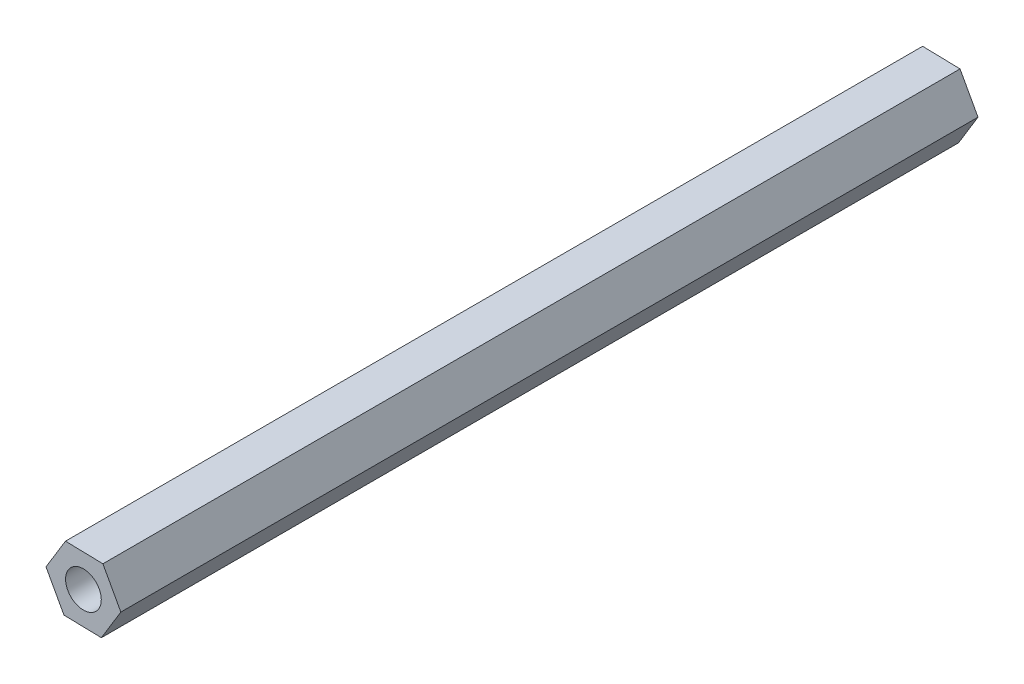
from build123d import *

# Parameters (mm, degrees)
EXTRUDE_1_DEPTH        = 60
HOLE_WIZARD_M3_1_D     = 2.5
HOLE_WIZARD_M3_1_DEPTH = 15
HOLE_WIZARD_M3_1_TIP   = 0.751075774
HOLE_WIZARD_M3_2_D     = 2.5
HOLE_WIZARD_M3_2_DEPTH = 15
HOLE_WIZARD_M3_2_TIP   = 0.751075774


with BuildPart() as part:
    # 草图1 → 凸台-拉伸1 (new body)
    with BuildSketch(Plane.XY):
        Polygon((1.363201019, 2.23742776), (-1.25606877, 2.299280593), (-2.619269789, 0.061852833), (-1.363201019, -2.23742776), (1.25606877, -2.299280593), (2.619269789, -0.061852833), align=None)
    extrude(amount=EXTRUDE_1_DEPTH)

    # M3 螺纹孔1
    with Locations(Plane.XY.offset(60)):
        with Locations((0, 0)):
            Hole(HOLE_WIZARD_M3_1_D / 2, depth=HOLE_WIZARD_M3_1_DEPTH)
            with Locations((0, 0, -(HOLE_WIZARD_M3_1_DEPTH + HOLE_WIZARD_M3_1_TIP / 2))):  # 118° drill point
                Cone(0, HOLE_WIZARD_M3_1_D / 2, HOLE_WIZARD_M3_1_TIP, mode=Mode.SUBTRACT)

    # M3 螺纹孔2
    with Locations(Plane(origin=(0, 0, 0), x_dir=(-1, 0, 0), z_dir=(0, 0, -1))):
        with Locations((0, 0)):
            Hole(HOLE_WIZARD_M3_2_D / 2, depth=HOLE_WIZARD_M3_2_DEPTH)
            with Locations((0, 0, -(HOLE_WIZARD_M3_2_DEPTH + HOLE_WIZARD_M3_2_TIP / 2))):  # 118° drill point
                Cone(0, HOLE_WIZARD_M3_2_D / 2, HOLE_WIZARD_M3_2_TIP, mode=Mode.SUBTRACT)


solid = part.part
